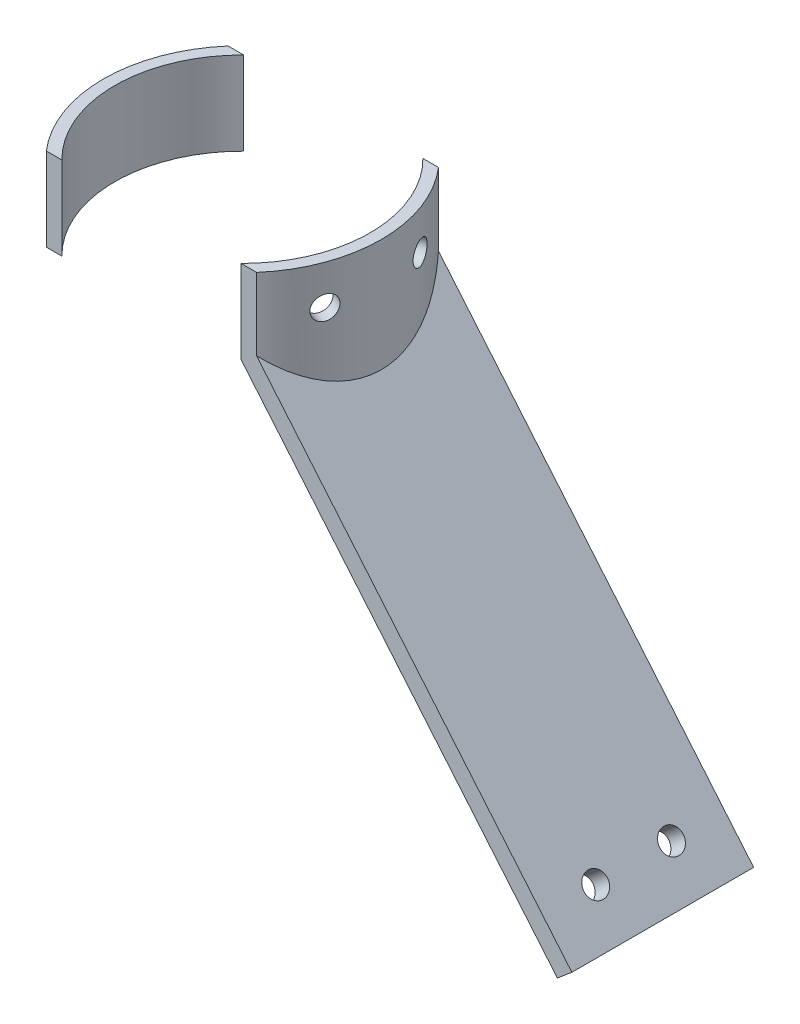
from build123d import *

# Parameters (mm, degrees)
BOSS_EXTRUDE1_DEPTH      = 10
BOSS_EXTRUDE1_DEPTH_BACK = 1
BOSS_EXTRUDE2_DEPTH      = 2.5
BOSS_EXTRUDE3_REACH      = 77.535
CUT_EXTRUDE1_REACH       = 85.202
SKETCH6_R                = 1.55
CUT_EXTRUDE2_DEPTH       = 2.5
CUT_EXTRUDE3_DEPTH       = 2.5
CUT_EXTRUDE3_DEPTH_BACK  = 2.5
SKETCH9_R                = 1.55
CUT_EXTRUDE4_DEPTH       = 2.5
CUT_EXTRUDE4_DEPTH_BACK  = 2.5
SKETCH8_R                = 1.55


with BuildPart() as part:
    # Sketch1 → Boss-Extrude1 (new, two sides: drawn at the far end of the back side and taken through both)
    with BuildSketch(Plane(origin=(0, 3.8, 0), x_dir=(1, 0, 0), z_dir=(0, 1, 0)).offset(-BOSS_EXTRUDE1_DEPTH_BACK)):
        with BuildLine():
            ThreePointArc((11.82888414, -12), (16.85, 0), (11.82888414, 12))
            Line((11.82888414, 12), (13.882452953, 12))
            ThreePointArc((13.882452953, 12), (18.35, 0), (13.882452953, -12))
            Line((13.882452953, -12), (11.82888414, -12))
        make_face()
        with BuildLine():
            Line((-11.82888414, -12), (-13.882452953, -12))
            ThreePointArc((-13.882452953, -12), (-18.35, 0), (-13.882452953, 12))
            Line((-13.882452953, 12), (-11.82888414, 12))
            ThreePointArc((-11.82888414, 12), (-16.85, 0), (-11.82888414, -12))
        make_face()
    extrude(amount=BOSS_EXTRUDE1_DEPTH + BOSS_EXTRUDE1_DEPTH_BACK)

    # Sketch3 → Boss-Extrude2 (add)
    with BuildSketch(Plane(origin=(8.327631, 6.978274302, 0), x_dir=(0, 0, -1), z_dir=(0.7664720008518675, 0.6422777217918545, 0))):
        Polygon((-12, -5.451307154), (-12, -6.770268653), (-12, -70.451307154), (12, -70.451307154), (12, -6.770268653), (12, -5.451307154), align=None)
    extrude(amount=BOSS_EXTRUDE2_DEPTH)

    # Boss-Extrude3: up to this face of the body (flat: up to its plane)
    boss_extrude3_end = Plane(part.part.faces().sort_by_distance((34.763054808, -20.676448222, 0))[0])
    # Sketch4 → Boss-Extrude3 (add, up to the picked face)
    with BuildSketch(Plane.XZ.offset(-2.8), mode=Mode.PRIVATE) as boss_extrude3_sk1:
        with BuildLine():
            Line((15.090581889, 10.440155087), (15.090581889, 7.496455045))
            ThreePointArc((15.090581889, 7.496455045), (16.85, 0), (15.090581889, -7.496455045))
            Line((15.090581889, -7.496455045), (15.090581889, -10.440155087))
            ThreePointArc((15.090581889, -10.440155087), (18.35, 0), (15.090581889, 10.440155087))
        make_face()
    boss_extrude3_tool1 = split(extrude(boss_extrude3_sk1.sketch, amount=BOSS_EXTRUDE3_REACH, mode=Mode.PRIVATE), bisect_by=boss_extrude3_end, keep=Keep.BOTH, mode=Mode.PRIVATE)
    add(boss_extrude3_tool1.solids().sort_by(Axis((15.301914, 2.8, 8.968305), (0, -1, 0)))[0])

    # Cut-Extrude1: up to this face of the body (flat: up to its plane)
    cut_extrude1_end = Plane(part.part.faces().sort_by_distance((32.702910098, -22.110340028, 0))[0])
    # Sketch5 → Cut-Extrude1 (cut, up to the picked face)
    with BuildSketch(Plane(origin=(0, 13.8, 0), x_dir=(1, 0, 0), z_dir=(0, 1, 0)), mode=Mode.PRIVATE) as cut_extrude1_sk1:
        with BuildLine():
            Line((11.82888414, 12), (11.82888414, -12))
            ThreePointArc((11.82888414, -12), (16.85, 0), (11.82888414, 12))
        make_face()
    cut_extrude1_tool1 = split(extrude(cut_extrude1_sk1.sketch, amount=-CUT_EXTRUDE1_REACH, mode=Mode.PRIVATE), bisect_by=cut_extrude1_end, keep=Keep.BOTH, mode=Mode.PRIVATE)
    add(cut_extrude1_tool1.solids().sort_by(Axis((13.865415, 13.8, 0), (0, -1, 0)))[0], mode=Mode.SUBTRACT)

    # Sketch6 → Cut-Extrude2 (cut)
    with BuildSketch(Plane(origin=(10.243811002, 8.583968606, 0), x_dir=(0, 0, -1), z_dir=(0.7664720008518675, 0.6422777217918545, 0))):
        with Locations(Location((-5, -64.451307154, 0), (0, 0, 90))):
            Circle(SKETCH6_R)
        with Locations(Location((5, -64.451307154, 0), (0, 0, 90))):
            Circle(SKETCH6_R)
    extrude(amount=-CUT_EXTRUDE2_DEPTH, mode=Mode.SUBTRACT)

    # Sketch9 → Cut-Extrude3 (cut, two sides: drawn at the far end of the back side and taken through both)
    with BuildSketch(Plane(origin=(16.115240106, 0, 5.865467716), x_dir=(0, 1, 0), z_dir=(0.9396926207859128, 0, 0.34202014332565694)).offset(-CUT_EXTRUDE3_DEPTH_BACK)):
        with Locations(Location((8.6, 0.028232901, 0), (0, 0, 90))):
            Circle(SKETCH9_R)
    extrude(amount=CUT_EXTRUDE3_DEPTH + CUT_EXTRUDE3_DEPTH_BACK, mode=Mode.SUBTRACT)

    # Sketch8 → Cut-Extrude4 (cut, two sides: drawn at the far end of the back side and taken through both)
    with BuildSketch(Plane(origin=(16.115240106, 0, -5.865467716), x_dir=(0, 1, 0), z_dir=(0.9396926207859081, 0, -0.34202014332566943)).offset(-CUT_EXTRUDE4_DEPTH_BACK)):
        with Locations(Location((8.6, -0.028232901, 0), (0, 0, 90))):
            Circle(SKETCH8_R)
    extrude(amount=CUT_EXTRUDE4_DEPTH + CUT_EXTRUDE4_DEPTH_BACK, mode=Mode.SUBTRACT)


solid = part.part
